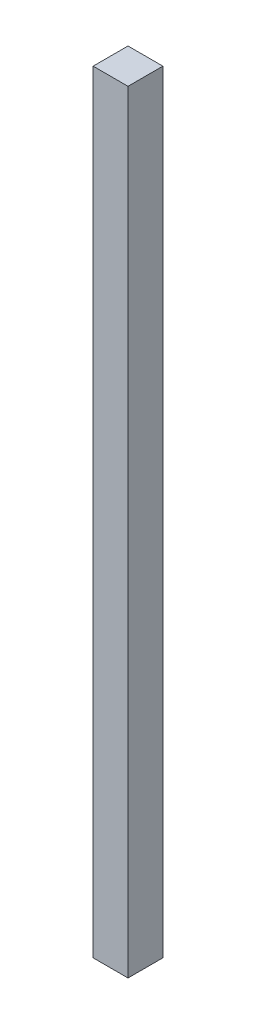
from build123d import *

# Parameters (mm, degrees)
BOSS_EXTRUDE1_DEPTH = 350


with BuildPart() as part:
    # Sketch1 → Boss-Extrude1 (new body)
    with BuildSketch(Plane(origin=(0, 0, 0), x_dir=(1, 0, 0), z_dir=(0, 1, 0))):
        Polygon((-7.905694151, 7.90569415), (7.90569415, 7.90569415), (7.90569415, -7.90569415), (-7.90569415, -7.90569415), align=None)
    extrude(amount=BOSS_EXTRUDE1_DEPTH)


solid = part.part
